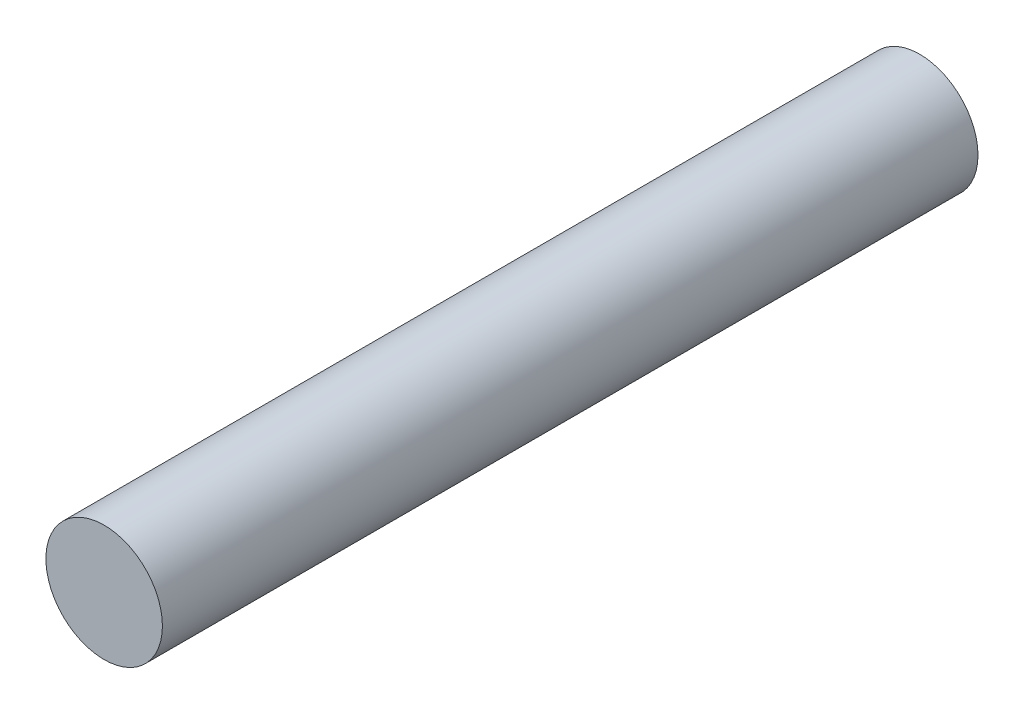
from build123d import *

# Parameters (mm, degrees)
SKETCH_1_R      = 1
EXTRUDE_1_DEPTH = 14


with BuildPart() as part:
    # Эскиз1 → Бобышка-Вытянуть1 (new body)
    with BuildSketch(Plane.XY):
        Circle(SKETCH_1_R)
    extrude(amount=EXTRUDE_1_DEPTH)


solid = part.part
